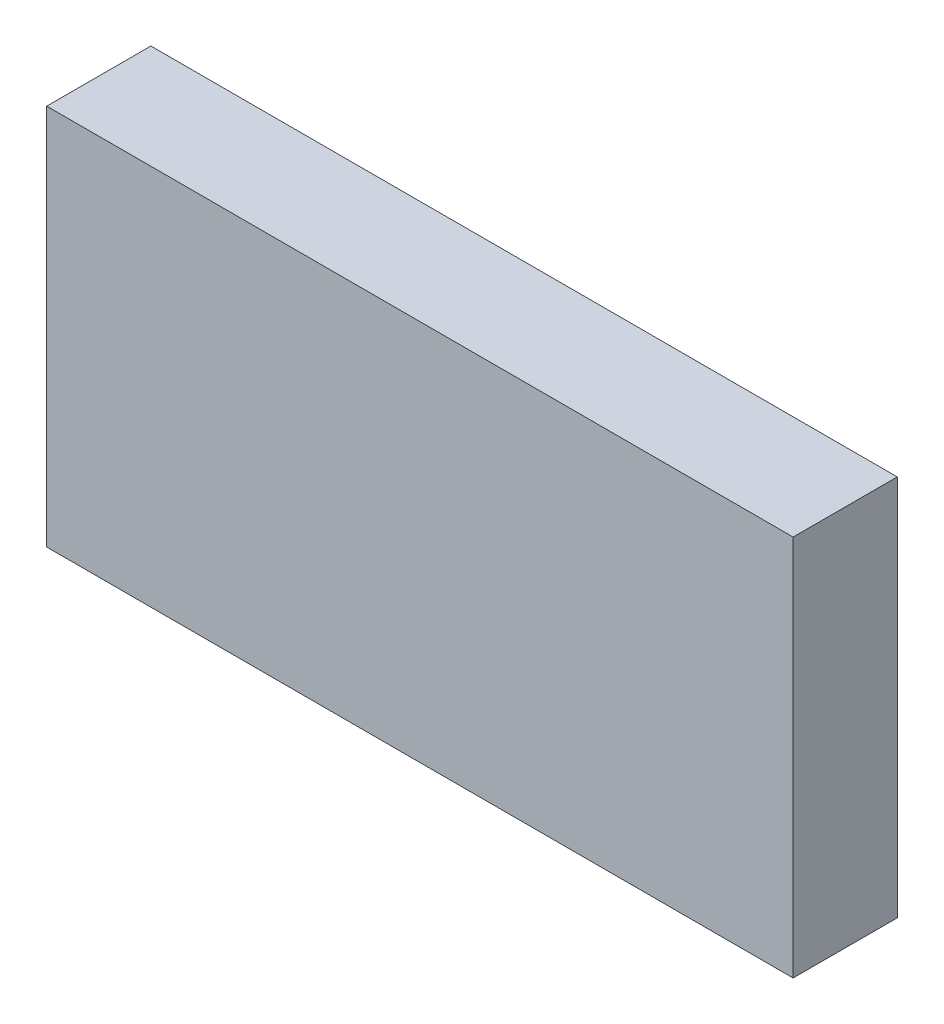
from build123d import *

# Parameters (mm, degrees)
SKETCH2_W           = 215
SKETCH2_H           = 30
BOSS_EXTRUDE1_DEPTH = 110


with BuildPart() as part:
    # Sketch2 → Boss-Extrude1 (new body)
    with BuildSketch(Plane(origin=(0, 0, 0), x_dir=(1, 0, 0), z_dir=(0, 1, 0))):
        Rectangle(SKETCH2_W, SKETCH2_H)
    extrude(amount=BOSS_EXTRUDE1_DEPTH)


solid = part.part
